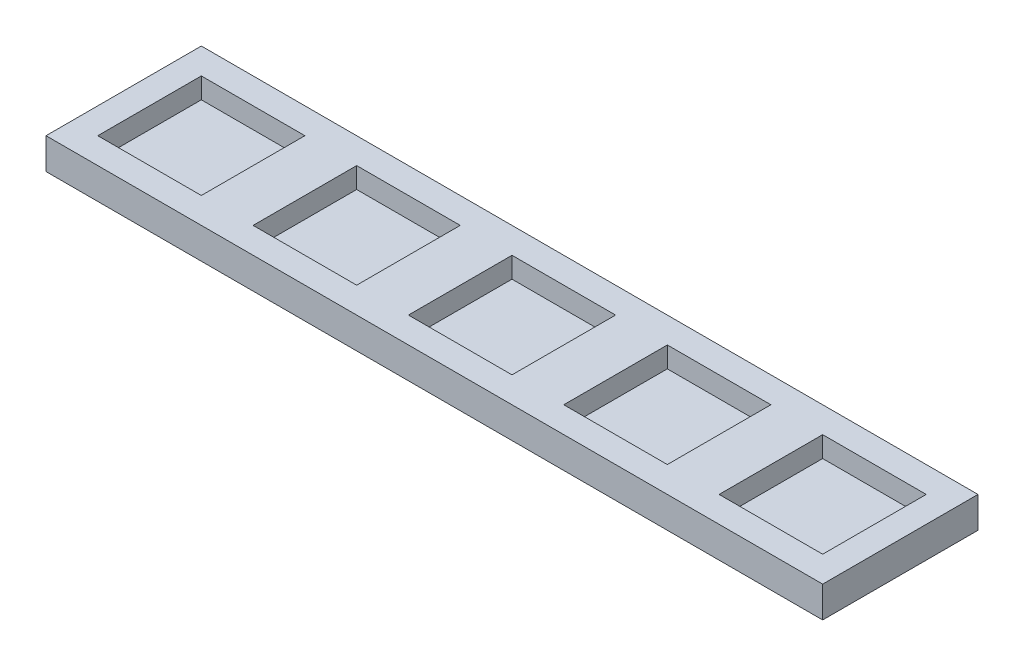
from build123d import *

# Parameters (mm, degrees)
SKETCH_1_W          = 750
SKETCH_1_H          = 150
EXTRUDE_1_DEPTH     = 30
SKETCH_2_W          = 100
SKETCH_2_H          = 100
CUT_EXTRUDE_1_DEPTH = 20


with BuildPart() as part:
    # 草图1 → 凸台-拉伸1 (new body)
    with BuildSketch(Plane(origin=(0, 0, 0), x_dir=(1, 0, 0), z_dir=(0, 1, 0))):
        with Locations((0, -75)):
            Rectangle(SKETCH_1_W, SKETCH_1_H)
    extrude(amount=EXTRUDE_1_DEPTH)

    # 草图2 → 切除-拉伸1 (cut)
    with BuildSketch(Plane(origin=(0, 30, 0), x_dir=(1, 0, 0), z_dir=(0, 1, 0))):
        with Locations((-150, -75)):
            Rectangle(SKETCH_2_W, SKETCH_2_H)
        with Locations((-300, -75)):
            Rectangle(SKETCH_2_W, SKETCH_2_H)
        with Locations((0, -75)):
            Rectangle(SKETCH_2_W, SKETCH_2_H)
        with Locations((150, -75)):
            Rectangle(SKETCH_2_W, SKETCH_2_H)
        with Locations((300, -75)):
            Rectangle(SKETCH_2_W, SKETCH_2_H)
    extrude(amount=-CUT_EXTRUDE_1_DEPTH, mode=Mode.SUBTRACT)


solid = part.part
